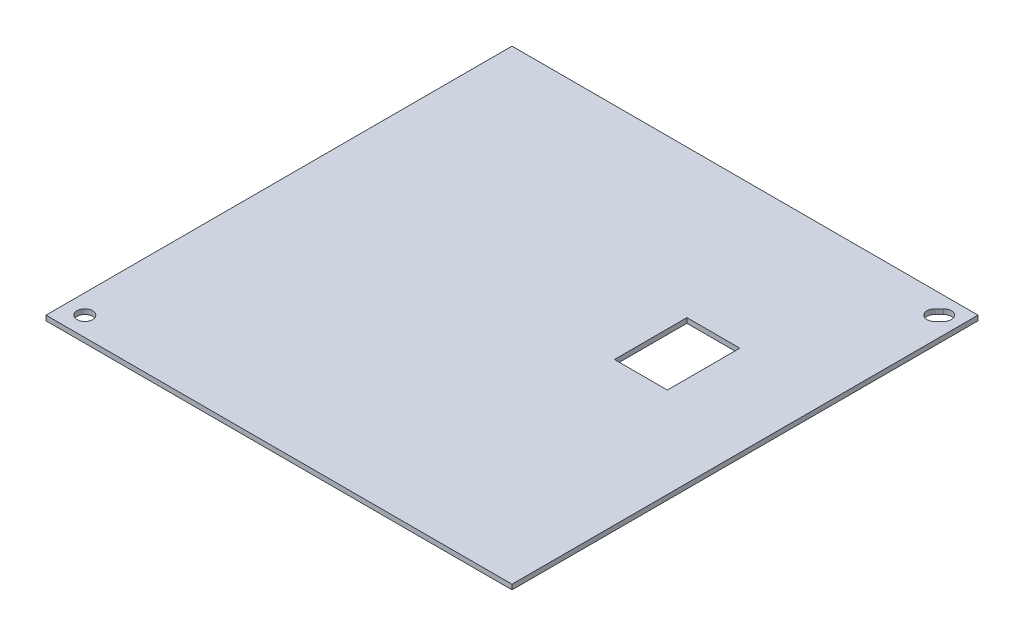
from build123d import *

# Parameters (mm, degrees)
SKETCH1_W           = 300
SKETCH1_H           = 300
BOSS_EXTRUDE1_DEPTH = 3.175
SKETCH2_R           = 5
CUT_EXTRUDE1_DEPTH  = 213.155793286
SKETCH3_W           = 34.06
SKETCH3_H           = 46.67
CUT_EXTRUDE2_DEPTH  = 213.155793286


with BuildPart() as part:
    # Sketch1 → Boss-Extrude1 (new body)
    with BuildSketch(Plane(origin=(0, 0, 0), x_dir=(1, 0, 0), z_dir=(0, 1, 0))):
        Rectangle(SKETCH1_W, SKETCH1_H)
    extrude(amount=BOSS_EXTRUDE1_DEPTH)

    # Sketch2 → Cut-Extrude1 (cut, through all)
    with BuildSketch(Plane(origin=(0, 3.175, 0), x_dir=(1, 0, 0), z_dir=(0, 1, 0))):
        with Locations(Location((-137.5, -137.5, 0), (0, 0, 270))):
            Circle(SKETCH2_R)
        with BuildLine():
            Line((142.449747468, 135.378679656), (139.621320344, 132.550252532))
            ThreePointArc((139.621320344, 132.550252532), (132.550252532, 132.550252532), (132.550252532, 139.621320344))
            Line((132.550252532, 139.621320344), (135.378679656, 142.449747468))
            ThreePointArc((135.378679656, 142.449747468), (142.449747468, 142.449747468), (142.449747468, 135.378679656))
        make_face()
    extrude(amount=-CUT_EXTRUDE1_DEPTH, mode=Mode.SUBTRACT)

    # Sketch3 → Cut-Extrude2 (cut, through all)
    with BuildSketch(Plane(origin=(0, 3.175, 0), x_dir=(1, 0, 0), z_dir=(0, 1, 0))):
        with Locations((74.716012632, 31.592141137)):
            Rectangle(SKETCH3_W, SKETCH3_H)
    extrude(amount=-CUT_EXTRUDE2_DEPTH, mode=Mode.SUBTRACT)


solid = part.part
